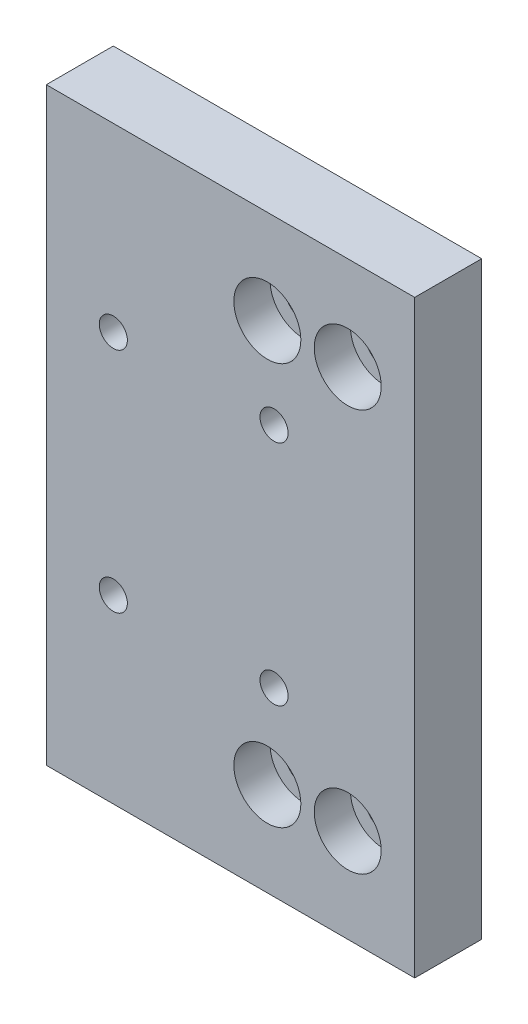
from build123d import *

# Parameters (mm, degrees)
SKETCH1_W                                           = 55
SKETCH1_H                                           = 88
BOSS_EXTRUDE1_DEPTH                                 = 10
M5_TAPPED_HOLE1_D                                   = 4.2
CBORE_FOR_M5_HEX_SOCKET_HEAD_CAP_SCREW1_D           = 5.5
CBORE_FOR_M5_HEX_SOCKET_HEAD_CAP_SCREW1_CBORE_D     = 10
CBORE_FOR_M5_HEX_SOCKET_HEAD_CAP_SCREW1_CBORE_DEPTH = 5.4


with BuildPart() as part:
    # Sketch1 → Boss-Extrude1 (new body)
    with BuildSketch(Plane.XY):
        Rectangle(SKETCH1_W, SKETCH1_H)
    extrude(amount=BOSS_EXTRUDE1_DEPTH)

    # M5 Tapped Hole1 (through all)
    with Locations(Plane.XY.offset(10)):
        with Locations((-17.5, 17), (6.5, 17), (-17.5, -17), (6.5, -17)):
            Hole(M5_TAPPED_HOLE1_D / 2)

    # CBORE for M5 Hex Socket Head Cap Screw1 (through all)
    with Locations(Plane.XY.offset(10)):
        with Locations((5.5, 30), (17.5, 30), (17.5, -30), (5.5, -30)):
            CounterBoreHole(CBORE_FOR_M5_HEX_SOCKET_HEAD_CAP_SCREW1_D / 2, CBORE_FOR_M5_HEX_SOCKET_HEAD_CAP_SCREW1_CBORE_D / 2, CBORE_FOR_M5_HEX_SOCKET_HEAD_CAP_SCREW1_CBORE_DEPTH)


solid = part.part
